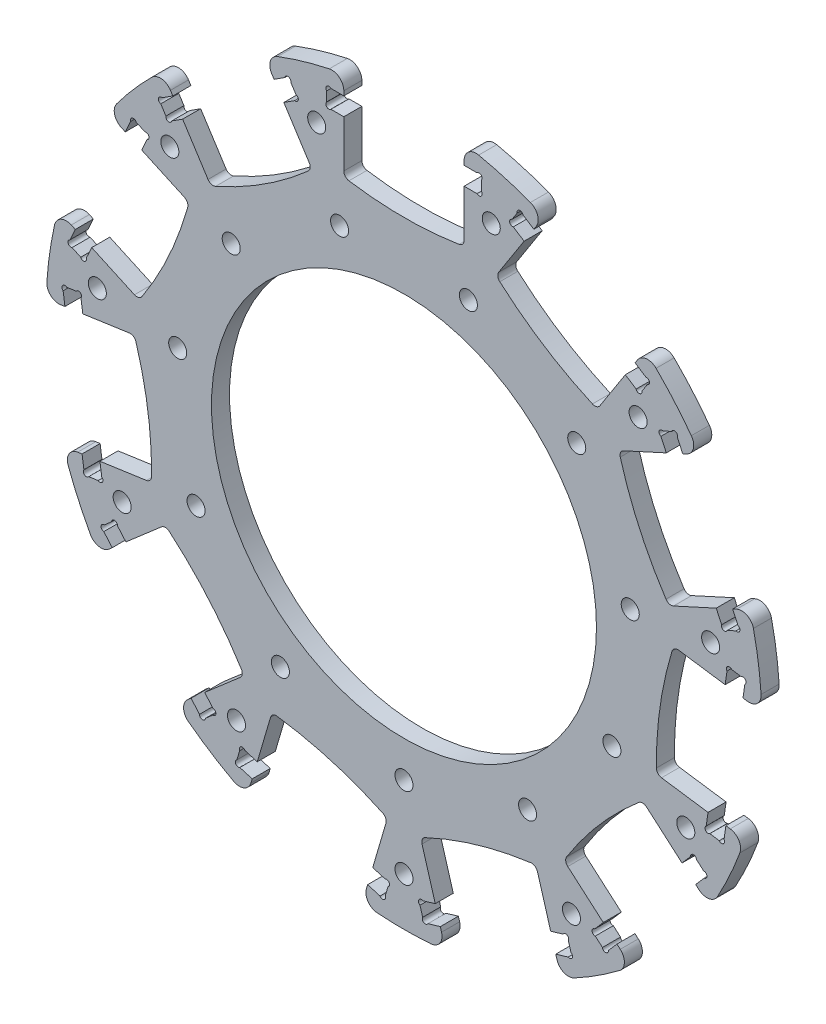
from build123d import *

# Parameters (mm, degrees)
SKETCH_2_R          = 32
SKETCH_2_R_2        = 1.5
EXTRUDE_1_DEPTH     = 1.5
FILLET_1_R          = 1
FILLET_2_R          = 2
SKETCH_3_W          = 2.85
SKETCH_3_H          = 3
CUT_EXTRUDE_1_DEPTH = 85.106848548
SKETCH_4_R          = 0.5
CUT_EXTRUDE_2_DEPTH = 85.106848548


with BuildPart() as part:
    # 草图2 → 凸台-拉伸1 (new, symmetric)
    with BuildSketch(Plane.XY):
        with BuildLine():
            Line((10, 58.653644388), (10, 43.839202169))
            ThreePointArc((10, 43.839202169), (0, 43), (-10, 43.839202169))
            Line((-10, 43.839202169), (-10, 58.653644388))
            ThreePointArc((-10, 58.653644388), (-16.763087132, 57.08983193), (-23.29801892, 54.748993729))
            Line((-23.29801892, 54.748993729), (-15.288726769, 42.286291876))
            ThreePointArc((-15.288726769, 42.286291876), (-23.247555151, 36.173901912), (-32.113797426, 31.473475527))
            Line((-32.113797426, 31.473475527), (-40.123089577, 43.93617738))
            ThreePointArc((-40.123089577, 43.93617738), (-44.967099674, 38.96421367), (-49.199081449, 33.4619244))
            Line((-49.199081449, 33.4619244), (-35.723390814, 27.307782693))
            ThreePointArc((-35.723390814, 27.307782693), (-39.1141758, 17.862845559), (-44.031691074, 9.115142785))
            Line((-44.031691074, 9.115142785), (-57.50738171, 15.269284493))
            ThreePointArc((-57.50738171, 15.269284493), (-58.894375792, 8.467732877), (-59.479783242, 1.550930504))
            Line((-59.479783242, 1.550930504), (-44.816130685, 3.659245452))
            ThreePointArc((-44.816130685, 3.659245452), (-42.562322001, -6.119538046), (-41.969833919, -16.137183386))
            Line((-41.969833919, -16.137183386), (-56.633486477, -18.245498334))
            ThreePointArc((-56.633486477, -18.245498334), (-54.123103724, -24.717193274), (-50.87607412, -30.852472869))
            Line((-50.87607412, -30.852472869), (-39.680065719, -21.151076364))
            ThreePointArc((-39.680065719, -21.151076364), (-32.497231697, -28.15901156), (-26.58285104, -36.266067852))
            Line((-26.58285104, -36.266067852), (-37.778859441, -45.967464356))
            ThreePointArc((-37.778859441, -45.967464356), (-32.168128639, -50.054585203), (-26.119570938, -53.460434099))
            Line((-26.119570938, -53.460434099), (-21.945860253, -39.246080882))
            ThreePointArc((-21.945860253, -39.246080882), (-12.114499944, -41.258197865), (-2.756000781, -44.880732018))
            Line((-2.756000781, -44.880732018), (-6.929711465, -59.095085236))
            ThreePointArc((-6.929711465, -59.095085236), (0, -59.5), (6.929711465, -59.095085236))
            Line((6.929711465, -59.095085236), (2.756000781, -44.880732018))
            ThreePointArc((2.756000781, -44.880732018), (12.114499944, -41.258197865), (21.945860253, -39.246080882))
            Line((21.945860253, -39.246080882), (26.119570938, -53.460434099))
            ThreePointArc((26.119570938, -53.460434099), (32.168128639, -50.054585203), (37.778859441, -45.967464356))
            Line((37.778859441, -45.967464356), (26.58285104, -36.266067852))
            ThreePointArc((26.58285104, -36.266067852), (32.497231697, -28.15901156), (39.680065719, -21.151076364))
            Line((39.680065719, -21.151076364), (50.87607412, -30.852472869))
            ThreePointArc((50.87607412, -30.852472869), (54.123103724, -24.717193274), (56.633486477, -18.245498334))
            Line((56.633486477, -18.245498334), (41.969833919, -16.137183386))
            ThreePointArc((41.969833919, -16.137183386), (42.562322001, -6.119538046), (44.816130685, 3.659245452))
            Line((44.816130685, 3.659245452), (59.479783242, 1.550930504))
            ThreePointArc((59.479783242, 1.550930504), (58.894375792, 8.467732877), (57.50738171, 15.269284493))
            Line((57.50738171, 15.269284493), (44.031691074, 9.115142785))
            ThreePointArc((44.031691074, 9.115142785), (39.1141758, 17.862845559), (35.723390814, 27.307782693))
            Line((35.723390814, 27.307782693), (49.199081449, 33.4619244))
            ThreePointArc((49.199081449, 33.4619244), (44.967099674, 38.96421367), (40.123089577, 43.93617738))
            Line((40.123089577, 43.93617738), (32.113797426, 31.473475527))
            ThreePointArc((32.113797426, 31.473475527), (23.247555151, 36.173901912), (15.288726769, 42.286291876))
            Line((15.288726769, 42.286291876), (23.29801892, 54.748993729))
            ThreePointArc((23.29801892, 54.748993729), (16.763087132, 57.08983193), (10, 58.653644388))
        make_face()
        Circle(SKETCH_2_R, mode=Mode.SUBTRACT)
        with Locations((0, -51.5)):
            Circle(SKETCH_2_R_2, mode=Mode.SUBTRACT)
        with Locations((-27.843002099, -43.324556941)):
            Circle(SKETCH_2_R_2, mode=Mode.SUBTRACT)
        with Locations((-46.846047761, -21.39387317)):
            Circle(SKETCH_2_R_2, mode=Mode.SUBTRACT)
        with Locations((-50.975804257, 7.329214171)):
            Circle(SKETCH_2_R_2, mode=Mode.SUBTRACT)
        with Locations((-38.921103079, 33.725327798)):
            Circle(SKETCH_2_R_2, mode=Mode.SUBTRACT)
        with Locations((-14.509226677, 49.413888141)):
            Circle(SKETCH_2_R_2, mode=Mode.SUBTRACT)
        with Locations((14.509226677, 49.413888141)):
            Circle(SKETCH_2_R_2, mode=Mode.SUBTRACT)
        with Locations((38.921103079, 33.725327798)):
            Circle(SKETCH_2_R_2, mode=Mode.SUBTRACT)
        with Locations((50.975804257, 7.329214171)):
            Circle(SKETCH_2_R_2, mode=Mode.SUBTRACT)
        with Locations((46.846047761, -21.39387317)):
            Circle(SKETCH_2_R_2, mode=Mode.SUBTRACT)
        with Locations((27.843002099, -43.324556941)):
            Circle(SKETCH_2_R_2, mode=Mode.SUBTRACT)
        with Locations((0, -38)):
            Circle(SKETCH_2_R_2, mode=Mode.SUBTRACT)
        with Locations((-20.544351063, -31.967634248)):
            Circle(SKETCH_2_R_2, mode=Mode.SUBTRACT)
        with Locations((-34.566015823, -15.785770494)):
            Circle(SKETCH_2_R_2, mode=Mode.SUBTRACT)
        with Locations((-37.613214791, 5.407963854)):
            Circle(SKETCH_2_R_2, mode=Mode.SUBTRACT)
        with Locations((-28.718483825, 24.88470789)):
            Circle(SKETCH_2_R_2, mode=Mode.SUBTRACT)
        with Locations((-10.70583716, 36.460732997)):
            Circle(SKETCH_2_R_2, mode=Mode.SUBTRACT)
        with Locations((10.70583716, 36.460732997)):
            Circle(SKETCH_2_R_2, mode=Mode.SUBTRACT)
        with Locations((28.718483825, 24.88470789)):
            Circle(SKETCH_2_R_2, mode=Mode.SUBTRACT)
        with Locations((37.613214791, 5.407963854)):
            Circle(SKETCH_2_R_2, mode=Mode.SUBTRACT)
        with Locations((34.566015823, -15.785770494)):
            Circle(SKETCH_2_R_2, mode=Mode.SUBTRACT)
        with Locations((20.544351063, -31.967634248)):
            Circle(SKETCH_2_R_2, mode=Mode.SUBTRACT)
    extrude(amount=EXTRUDE_1_DEPTH, both=True)

    # 圆角1
    fillet_1_edges = [part.edges().sort_by_distance(p)[0] for p in [
        (10, 43.839202169, 0),
        (-10, 43.839202169, 0),
        (-15.288726769, 42.286291876, 0),
        (-32.113797426, 31.473475527, 0),
        (-35.723390814, 27.307782693, 0),
        (-44.031691074, 9.115142785, 0),
        (-44.816130685, 3.659245452, 0),
        (-41.969833919, -16.137183386, 0),
        (-39.680065719, -21.151076364, 0),
        (-26.58285104, -36.266067852, 0),
        (-21.945860253, -39.246080882, 0),
        (-2.756000781, -44.880732018, 0),
        (2.756000781, -44.880732018, 0),
        (21.945860253, -39.246080882, 0),
        (26.58285104, -36.266067852, 0),
        (39.680065719, -21.151076364, 0),
        (41.969833919, -16.137183386, 0),
        (44.816130685, 3.659245452, 0),
        (44.031691074, 9.115142785, 0),
        (35.723390814, 27.307782693, 0),
        (32.113797426, 31.473475527, 0),
        (15.288726769, 42.286291876, 0),
    ]]
    fillet(fillet_1_edges, radius=FILLET_1_R)

    # 圆角2
    fillet_2_edges = [part.edges().sort_by_distance(p)[0] for p in [
        (10, 58.653644388, 0),
        (-10, 58.653644388, 0),
        (-23.29801892, 54.748993729, 0),
        (-40.123089577, 43.93617738, 0),
        (-49.199081449, 33.4619244, 0),
        (-57.50738171, 15.269284493, 0),
        (-59.479783242, 1.550930504, 0),
        (-56.633486477, -18.245498334, 0),
        (-50.87607412, -30.852472869, 0),
        (-37.778859441, -45.967464356, 0),
        (-26.119570938, -53.460434099, 0),
        (-6.929711465, -59.095085236, 0),
        (6.929711465, -59.095085236, 0),
        (26.119570938, -53.460434099, 0),
        (37.778859441, -45.967464356, 0),
        (50.87607412, -30.852472869, 0),
        (56.633486477, -18.245498334, 0),
        (59.479783242, 1.550930504, 0),
        (57.50738171, 15.269284493, 0),
        (49.199081449, 33.4619244, 0),
        (40.123089577, 43.93617738, 0),
        (23.29801892, 54.748993729, 0),
    ]]
    fillet(fillet_2_edges, radius=FILLET_2_R)

    # 草图3 → 切除-拉伸1 (cut, through all)
    with BuildSketch(Plane.XY.offset(1.5)):
        with Locations((-11.425, 54)):
            Rectangle(SKETCH_3_W, SKETCH_3_H)
        with Locations((11.425, 54)):
            Rectangle(SKETCH_3_W, SKETCH_3_H)
        Polygon((19.971107588, 49.572218648), (17.57353502, 51.113044978), (19.195457472, 53.636805576), (21.59303004, 52.095979247), align=None)
        Polygon((38.418100697, 41.283162898), (40.815673266, 39.742336568), (39.193750813, 37.218575969), (36.796178245, 38.759402299), align=None)
        Polygon((43.601529626, 30.905608136), (42.417596839, 33.498059323), (45.146492825, 34.744304362), (46.330425612, 32.151853175), align=None)
        Polygon((54.638725872, 13.959213268), (55.822658659, 11.366762081), (53.093762673, 10.120517042), (51.909829886, 12.712968229), align=None)
        Polygon((53.388774081, 2.426685409), (53.794371371, 5.247676519), (56.763835696, 4.820732004), (56.358238407, 1.999740895), align=None)
        Polygon((53.511941642, -17.796687943), (53.106344353, -20.617679052), (50.136880027, -20.190734538), (50.542477316, -17.369743428), align=None)
        Polygon((46.225459993, -26.822692789), (48.091813085, -24.668806502), (50.359061808, -26.633388704), (48.492708716, -28.78727499), align=None)
        Polygon((35.395494037, -43.902266478), (33.529140945, -46.056152764), (31.261892222, -44.091570563), (33.128245314, -41.937684276), align=None)
        Polygon((24.38588897, -47.556055546), (27.120443945, -46.753117759), (27.965641616, -49.63159668), (25.231086641, -50.434534467), align=None)
        Polygon((6.041227169, -56.069185604), (3.306672194, -56.872123391), (2.461474523, -53.99364447), (5.196029498, -53.190706683), align=None)
        Polygon((-5.196029498, -53.190706683), (-2.461474523, -53.99364447), (-3.306672194, -56.872123391), (-6.041227169, -56.069185604), align=None)
        Polygon((-25.231086641, -50.434534467), (-27.965641616, -49.63159668), (-27.120443945, -46.753117759), (-24.38588897, -47.556055546), align=None)
        Polygon((-33.128245314, -41.937684276), (-31.261892222, -44.091570563), (-33.529140945, -46.056152764), (-35.395494037, -43.902266478), align=None)
        Polygon((-48.492708716, -28.78727499), (-50.359061808, -26.633388704), (-48.091813085, -24.668806502), (-46.225459993, -26.822692789), align=None)
        Polygon((-50.542477316, -17.369743428), (-50.136880027, -20.190734538), (-53.106344353, -20.617679052), (-53.511941642, -17.796687943), align=None)
        Polygon((-56.358238407, 1.999740895), (-56.763835696, 4.820732004), (-53.794371371, 5.247676519), (-53.388774081, 2.426685409), align=None)
        Polygon((-51.909829886, 12.712968229), (-53.093762673, 10.120517042), (-55.822658659, 11.366762081), (-54.638725872, 13.959213268), align=None)
        Polygon((-46.330425612, 32.151853175), (-45.146492825, 34.744304362), (-42.417596839, 33.498059323), (-43.601529626, 30.905608136), align=None)
        Polygon((-36.796178245, 38.759402299), (-39.193750813, 37.218575969), (-40.815673266, 39.742336568), (-38.418100697, 41.283162898), align=None)
        Polygon((-21.59303004, 52.095979247), (-19.195457472, 53.636805576), (-17.57353502, 51.113044978), (-19.971107588, 49.572218648), align=None)
    extrude(amount=-CUT_EXTRUDE_1_DEPTH, mode=Mode.SUBTRACT)

    # 草图4 → 切除-拉伸2 (cut, through all)
    with BuildSketch(Plane.XY.offset(1.5)):
        with Locations((12.496446609, 55.146446609)):
            Circle(SKETCH_4_R)
        with Locations((12.496446609, 52.853553391)):
            Circle(SKETCH_4_R)
        with Locations((-12.496446609, 55.146446609)):
            Circle(SKETCH_4_R)
        with Locations((-12.496446609, 52.853553391)):
            Circle(SKETCH_4_R)
        with Locations((19.301740117, 53.148232143)):
            Circle(SKETCH_4_R)
        with Locations((18.062108453, 51.219327623)):
            Circle(SKETCH_4_R)
        with Locations((40.327099833, 39.636053923)):
            Circle(SKETCH_4_R)
        with Locations((39.087468169, 37.707149402)):
            Circle(SKETCH_4_R)
        with Locations((44.971760735, 34.275829499)):
            Circle(SKETCH_4_R)
        with Locations((42.886071702, 33.323327233)):
            Circle(SKETCH_4_R)
        with Locations((55.354183797, 11.541494171)):
            Circle(SKETCH_4_R)
        with Locations((53.268494763, 10.588991905)):
            Circle(SKETCH_4_R)
        with Locations((56.363565076, 4.521093171)):
            Circle(SKETCH_4_R)
        with Locations((54.094010204, 4.847405898)):
            Circle(SKETCH_4_R)
        with Locations((52.806705519, -20.217408432)):
            Circle(SKETCH_4_R)
        with Locations((50.537150647, -19.891095704)):
            Circle(SKETCH_4_R)
        with Locations((49.860335751, -26.669058295)):
            Circle(SKETCH_4_R)
        with Locations((48.127482676, -25.167532559)):
            Circle(SKETCH_4_R)
        with Locations((33.493471354, -45.557426707)):
            Circle(SKETCH_4_R)
        with Locations((31.76061828, -44.055900971)):
            Circle(SKETCH_4_R)
        with Locations((27.526802121, -49.391972187)):
            Circle(SKETCH_4_R)
        with Locations((26.880819452, -47.191957254)):
            Circle(SKETCH_4_R)
        with Locations((3.546296687, -56.433283896)):
            Circle(SKETCH_4_R)
        with Locations((2.900314018, -54.233268964)):
            Circle(SKETCH_4_R)
        with Locations((-3.546296687, -56.433283896)):
            Circle(SKETCH_4_R)
        with Locations((-2.900314018, -54.233268964)):
            Circle(SKETCH_4_R)
        with Locations((-27.526802121, -49.391972187)):
            Circle(SKETCH_4_R)
        with Locations((-26.880819452, -47.191957254)):
            Circle(SKETCH_4_R)
        with Locations((-33.493471354, -45.557426707)):
            Circle(SKETCH_4_R)
        with Locations((-31.76061828, -44.055900971)):
            Circle(SKETCH_4_R)
        with Locations((-49.860335751, -26.669058295)):
            Circle(SKETCH_4_R)
        with Locations((-48.127482676, -25.167532559)):
            Circle(SKETCH_4_R)
        with Locations((-52.806705519, -20.217408432)):
            Circle(SKETCH_4_R)
        with Locations((-50.537150647, -19.891095704)):
            Circle(SKETCH_4_R)
        with Locations((-56.363565076, 4.521093171)):
            Circle(SKETCH_4_R)
        with Locations((-54.094010204, 4.847405898)):
            Circle(SKETCH_4_R)
        with Locations((-55.354183797, 11.541494171)):
            Circle(SKETCH_4_R)
        with Locations((-53.268494763, 10.588991905)):
            Circle(SKETCH_4_R)
        with Locations((-44.971760735, 34.275829499)):
            Circle(SKETCH_4_R)
        with Locations((-42.886071702, 33.323327233)):
            Circle(SKETCH_4_R)
        with Locations((-40.327099833, 39.636053923)):
            Circle(SKETCH_4_R)
        with Locations((-39.087468169, 37.707149402)):
            Circle(SKETCH_4_R)
        with Locations((-19.301740117, 53.148232143)):
            Circle(SKETCH_4_R)
        with Locations((-18.062108453, 51.219327623)):
            Circle(SKETCH_4_R)
    extrude(amount=-CUT_EXTRUDE_2_DEPTH, mode=Mode.SUBTRACT)


solid = part.part
